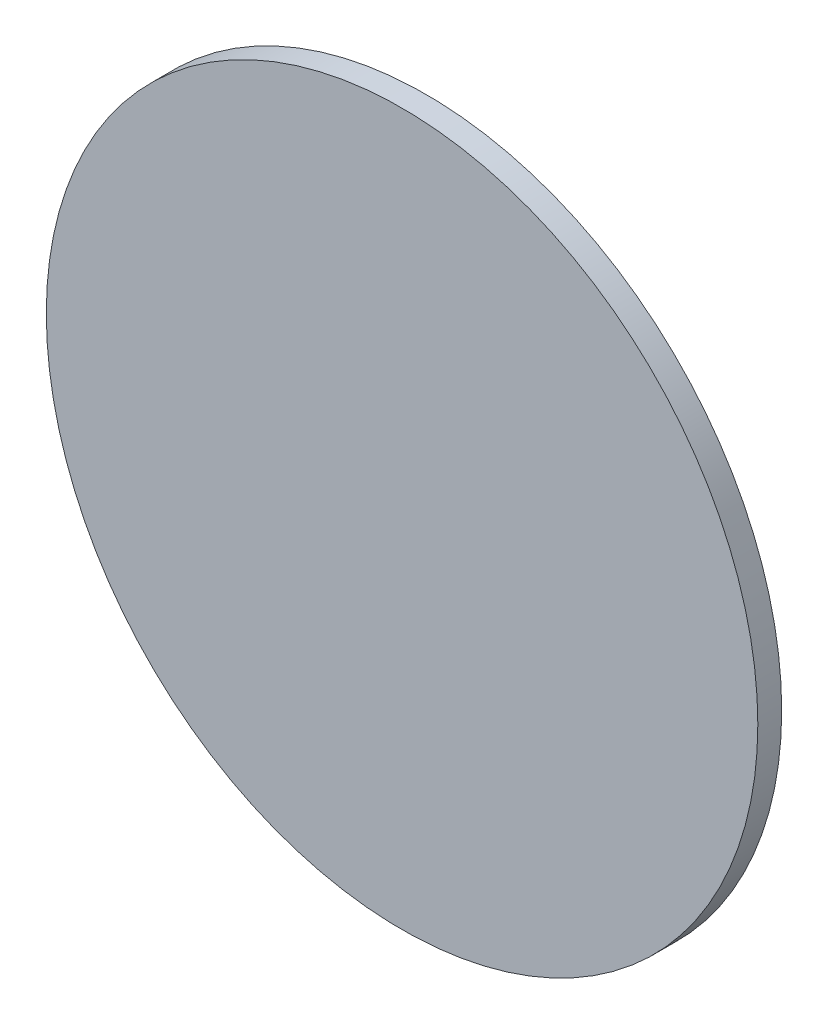
from build123d import *

# Parameters (mm, degrees)
ESQUISSE1_R        = 74.5
BOSS_EXTRU_1_DEPTH = 5


with BuildPart() as part:
    # Esquisse1 → Boss.-Extru.1 (new body)
    with BuildSketch(Plane.XY):
        Circle(ESQUISSE1_R)
    extrude(amount=BOSS_EXTRU_1_DEPTH)


solid = part.part
